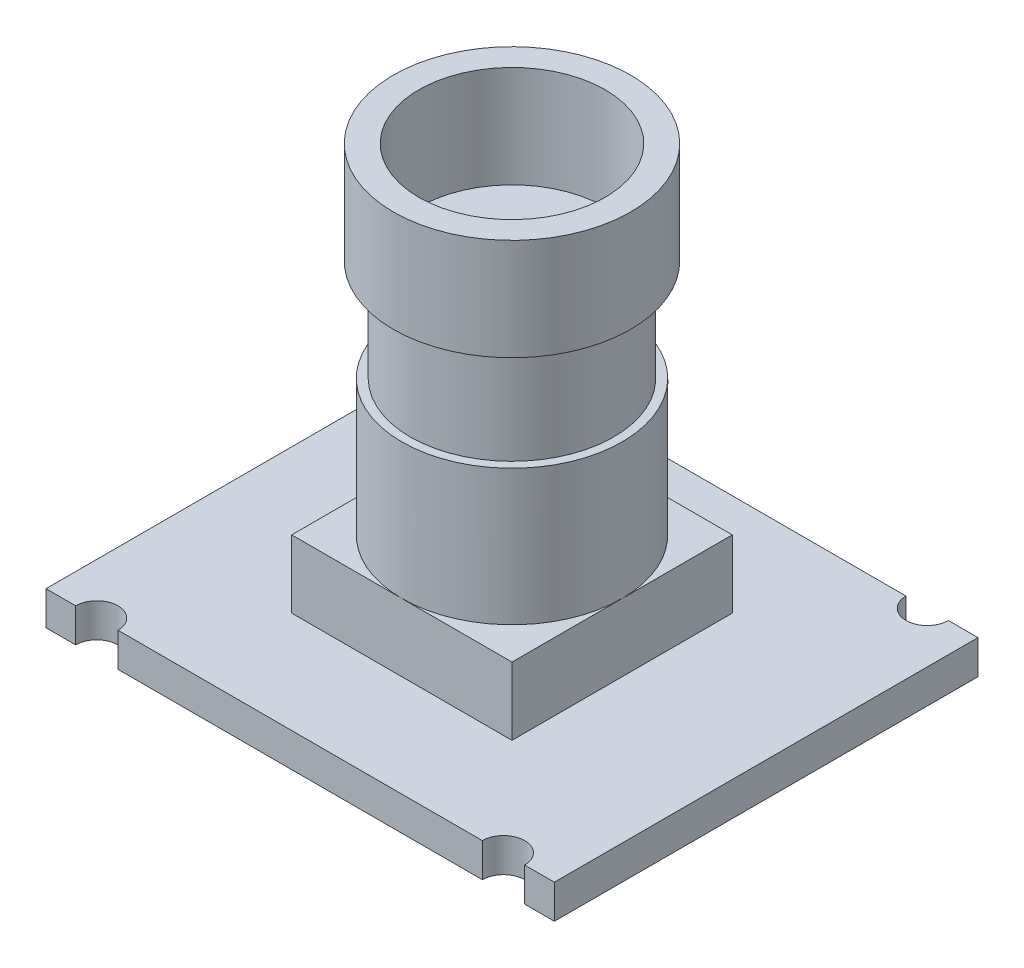
from build123d import *

# Parameters (mm, degrees)
SKETCH_1_W          = 30
SKETCH_1_H          = 25
EXTRUDE_1_DEPTH     = 2
SKETCH_2_R          = 1.25
CUT_EXTRUDE_1_DEPTH = 20.627786426
SKETCH_3_W          = 13
SKETCH_3_H          = 13
EXTRUDE_2_DEPTH     = 4
SKETCH_4_R          = 6.5
EXTRUDE_3_DEPTH     = 8
SKETCH_5_R          = 6
EXTRUDE_4_DEPTH     = 6
SKETCH_6_R          = 7
SKETCH_6_R_2        = 5.5
EXTRUDE_5_DEPTH     = 6


with BuildPart() as part:
    # 草圖1 → 填料-伸長1 (new body)
    with BuildSketch(Plane(origin=(0, 0, 0), x_dir=(1, 0, 0), z_dir=(0, 1, 0))):
        Rectangle(SKETCH_1_W, SKETCH_1_H)
    extrude(amount=EXTRUDE_1_DEPTH)

    # 草圖2 → 除料-伸長1 (cut, through all)
    with BuildSketch(Plane(origin=(0, 2, 0), x_dir=(1, 0, 0), z_dir=(0, 1, 0))):
        with Locations((-12, 12.5)):
            Circle(SKETCH_2_R)
        with Locations((-12, -12.5)):
            Circle(SKETCH_2_R)
    cut_extrude_1 = extrude(amount=-CUT_EXTRUDE_1_DEPTH, mode=Mode.SUBTRACT)

    # 鏡射1: 除料-伸長1 across plane
    add(cut_extrude_1.mirror(Plane(origin=(0, 0, 0), x_dir=(0, 0, 1), z_dir=(1, 0, 0))), mode=Mode.SUBTRACT)

    # 草圖3 → 填料-伸長2 (add)
    with BuildSketch(Plane(origin=(0, 2, 0), x_dir=(1, 0, 0), z_dir=(0, 1, 0))):
        Rectangle(SKETCH_3_W, SKETCH_3_H)
    extrude(amount=EXTRUDE_2_DEPTH)

    # 草圖4 → 填料-伸長3 (add)
    with BuildSketch(Plane(origin=(0, 6, 0), x_dir=(1, 0, 0), z_dir=(0, 1, 0))):
        with Locations(Location((0, 0, 0), (0, 0, 270))):
            Circle(SKETCH_4_R)
    extrude(amount=EXTRUDE_3_DEPTH)

    # 草圖5 → 填料-伸長4 (add)
    with BuildSketch(Plane(origin=(0, 14, 0), x_dir=(1, 0, 0), z_dir=(0, 1, 0))):
        with Locations(Location((0, 0, 0), (0, 0, 270))):
            Circle(SKETCH_5_R)
    extrude(amount=EXTRUDE_4_DEPTH)

    # 草圖6 → 填料-伸長5 (add)
    with BuildSketch(Plane(origin=(0, 20, 0), x_dir=(1, 0, 0), z_dir=(0, 1, 0))):
        with Locations(Location((0, 0, 0), (0, 0, 270))):
            Circle(SKETCH_6_R)
        with Locations(Location((0, 0, 0), (0, 0, 270))):
            Circle(SKETCH_6_R_2, mode=Mode.SUBTRACT)
    extrude(amount=EXTRUDE_5_DEPTH)


solid = part.part
